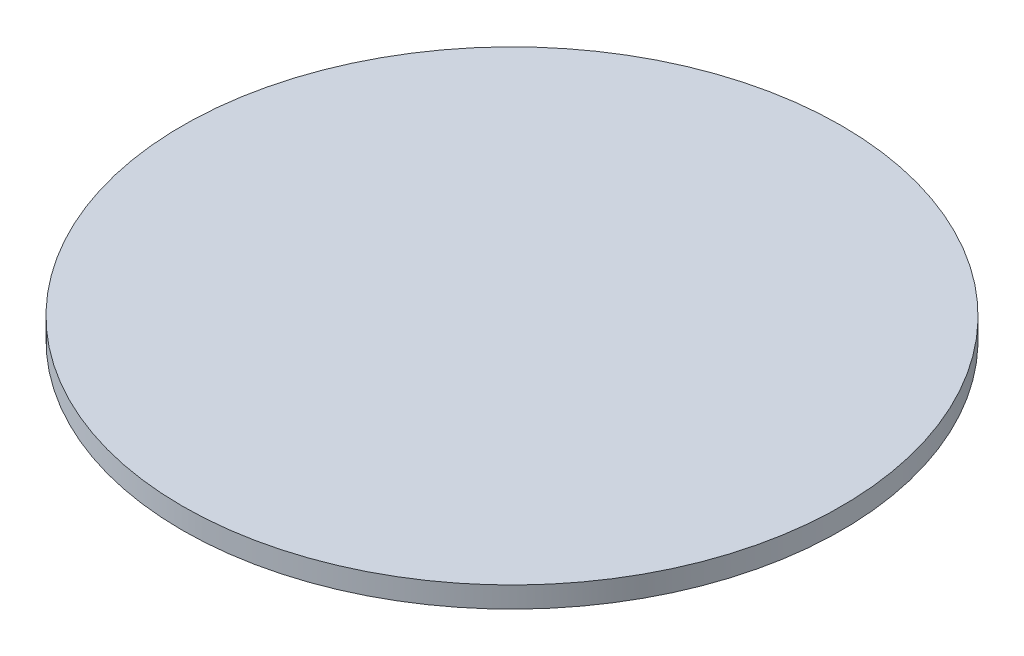
from build123d import *

# Parameters (mm, degrees)
SKETCH_1_R      = 15.75
EXTRUDE_1_DEPTH = 1


with BuildPart() as part:
    # Эскиз1 → Бобышка-Вытянуть1 (new body)
    with BuildSketch(Plane(origin=(0, 0, 0), x_dir=(1, 0, 0), z_dir=(0, 1, 0))):
        with Locations(Location((0, 0, 0), (0, 0, 270))):
            Circle(SKETCH_1_R)
    extrude(amount=EXTRUDE_1_DEPTH)


solid = part.part
